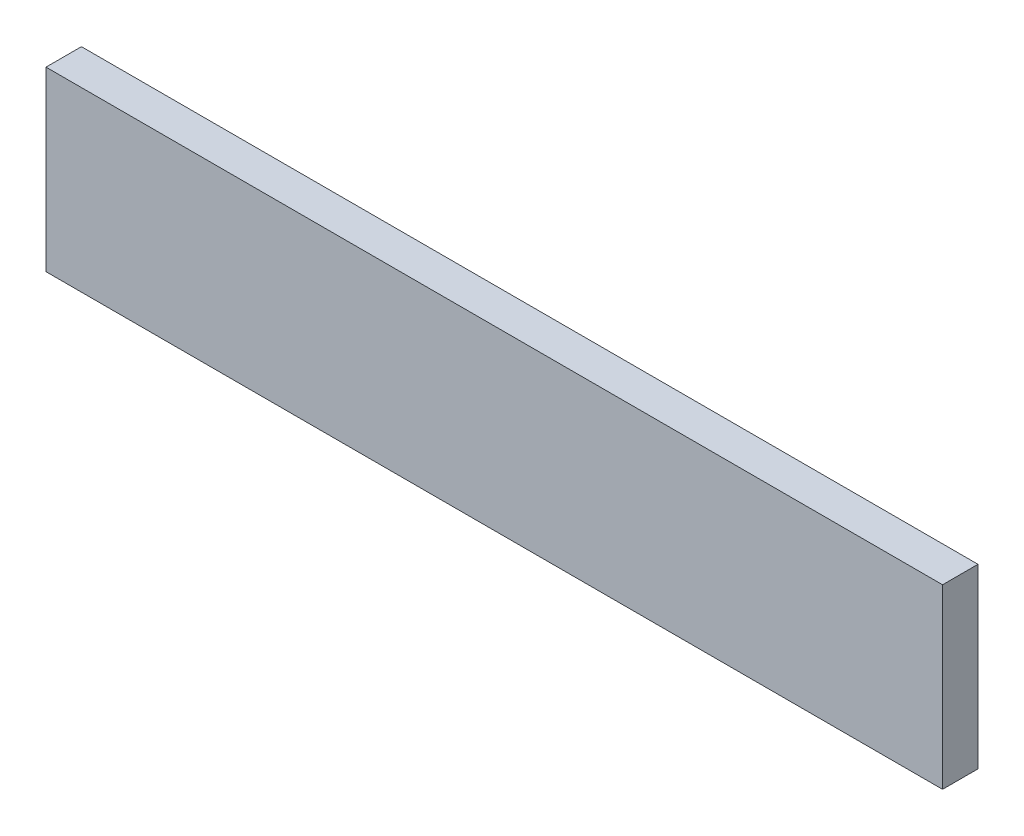
from build123d import *

# Parameters (mm, degrees)
SKETCH1_W           = 506
SKETCH1_H           = 100
BOSS_EXTRUDE1_DEPTH = 20


with BuildPart() as part:
    # Sketch1 → Boss-Extrude1 (new body)
    with BuildSketch(Plane.XY):
        with Locations((253, 50)):
            Rectangle(SKETCH1_W, SKETCH1_H)
    extrude(amount=BOSS_EXTRUDE1_DEPTH)


solid = part.part
